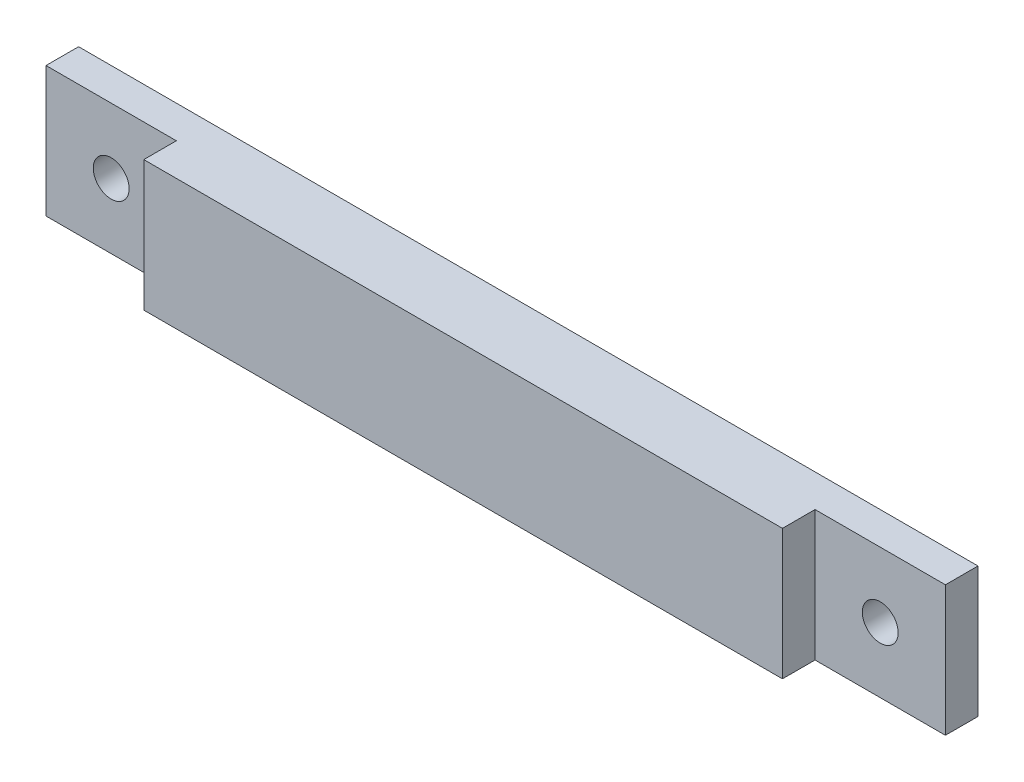
from build123d import *

# Parameters (mm, degrees)
ESQUISSE1_W        = 275.97
ESQUISSE1_H        = 40
ESQUISSE1_R        = 5.5
BOSS_EXTRU_1_DEPTH = 10
ESQUISSE2_W        = 195.97
ESQUISSE2_H        = 40
BOSS_EXTRU_2_DEPTH = 10


with BuildPart() as part:
    # Esquisse1 → Boss.-Extru.1 (new body)
    with BuildSketch(Plane.XY):
        with Locations((137.985, 20)):
            Rectangle(ESQUISSE1_W, ESQUISSE1_H)
        with Locations((20, 20)):
            Circle(ESQUISSE1_R, mode=Mode.SUBTRACT)
        with Locations(Location((255.97, 20, 0), (0, 0, 180))):
            Circle(ESQUISSE1_R, mode=Mode.SUBTRACT)
    extrude(amount=BOSS_EXTRU_1_DEPTH)

    # Esquisse2 → Boss.-Extru.2 (add)
    with BuildSketch(Plane.XY.offset(10)):
        with Locations((137.985, 20)):
            Rectangle(ESQUISSE2_W, ESQUISSE2_H)
    extrude(amount=BOSS_EXTRU_2_DEPTH)


solid = part.part
